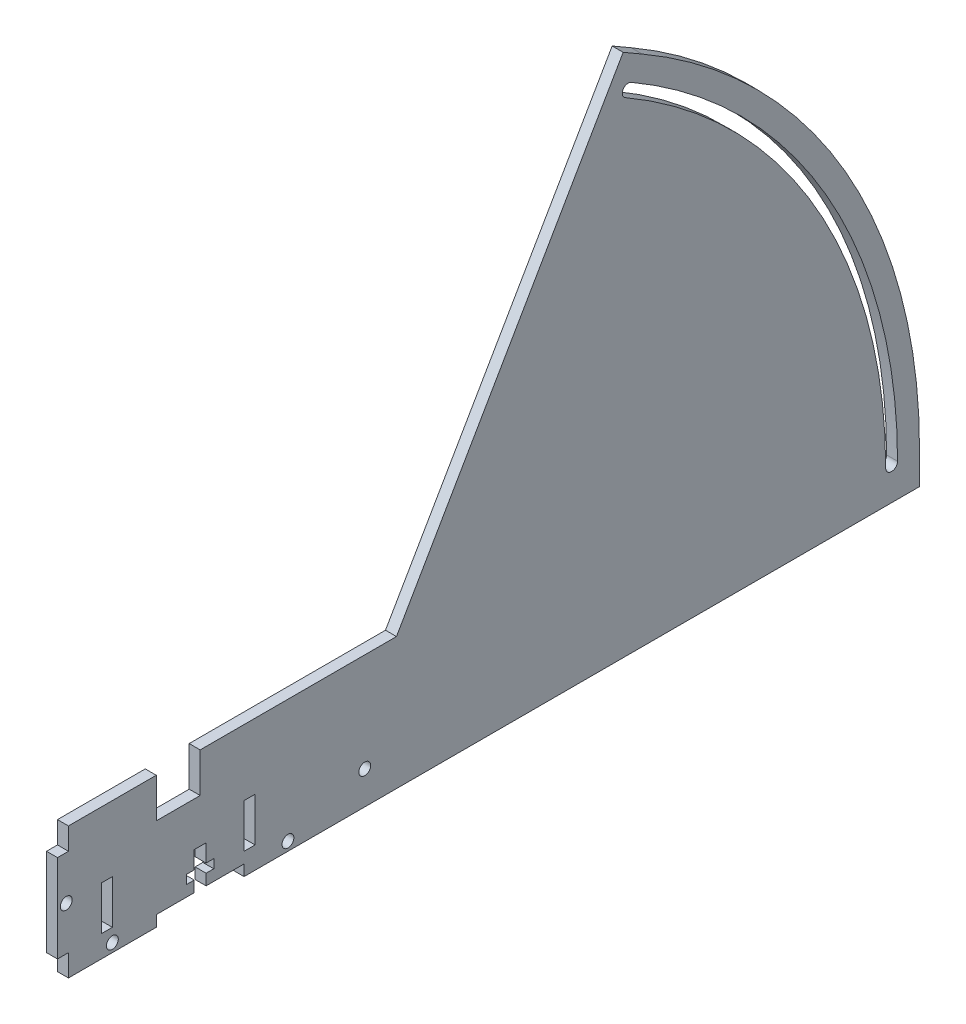
from build123d import *

# Parameters (mm, degrees)
SKETCH1_R           = 1.7145
SKETCH1_W           = 3.175
SKETCH1_H           = 12.7
BOSS_EXTRUDE2_DEPTH = 3.175


with BuildPart() as part:
    # Sketch1 → Boss-Extrude2 (new body)
    with BuildSketch(Plane(origin=(0, 0, 0), x_dir=(0, 0, -1), z_dir=(1, 0, 0))):
        with BuildLine():
            Line((0, 0), (160.4645, 0))
            Line((160.4645, 0), (160.4645, 9.53262))
            ThreePointArc((160.4645, 9.53262), (138.966333406, 89.76487), (80.23225, 148.498953406))
            Line((80.23225, 148.498953406), (74.732988686, 151.673953406))
            Line((74.732988686, 151.673953406), (9.161036114, 38.1))
            Line((9.161036114, 38.1), (-47.625, 38.1))
            Line((-47.625, 38.1), (-47.625, 26.67))
            Line((-47.625, 26.67), (-60.325, 26.67))
            Line((-60.325, 26.67), (-60.325, 38.1))
            Line((-60.325, 38.1), (-85.725, 38.1))
            Line((-85.725, 38.1), (-85.725, 31.75))
            Line((-85.725, 31.75), (-88.9, 31.75))
            Line((-88.9, 31.75), (-88.9, 6.35))
            Line((-88.9, 6.35), (-85.725, 6.35))
            Line((-85.725, 6.35), (-85.725, 0))
            Line((-85.725, 0), (-60.325, 0))
            Line((-60.325, 0), (-60.325, 3.175))
            Line((-60.325, 3.175), (-49.3395, 3.175))
            Line((-49.3395, 3.175), (-49.3395, 6.35))
            Line((-49.3395, 6.35), (-51.562, 6.35))
            Line((-51.562, 6.35), (-51.562, 8.89))
            Line((-51.562, 8.89), (-49.3395, 8.89))
            Line((-49.3395, 8.89), (-49.3395, 13.97))
            Line((-49.3395, 13.97), (-45.9105, 13.97))
            Line((-45.9105, 13.97), (-45.9105, 8.89))
            Line((-45.9105, 8.89), (-43.688, 8.89))
            Line((-43.688, 8.89), (-43.688, 6.35))
            Line((-43.688, 6.35), (-45.9105, 6.35))
            Line((-45.9105, 6.35), (-45.9105, 3.175))
            Line((-45.9105, 3.175), (-34.925, 3.175))
            Line((-34.925, 3.175), (-34.925, 0))
            Line((-34.925, 0), (0, 0))
        make_face()
        with Locations((-86.36, 19.05)):
            Circle(SKETCH1_R, mode=Mode.SUBTRACT)
        with Locations((0, 9.53262)):
            Circle(SKETCH1_R, mode=Mode.SUBTRACT)
        with Locations((-73.025, 2.54)):
            Circle(SKETCH1_R, mode=Mode.SUBTRACT)
        with Locations((-22.225, 2.54)):
            Circle(SKETCH1_R, mode=Mode.SUBTRACT)
        with Locations((-74.6125, 12.7)):
            Rectangle(SKETCH1_W, SKETCH1_H, mode=Mode.SUBTRACT)
        with Locations((-33.3375, 12.7)):
            Rectangle(SKETCH1_W, SKETCH1_H, mode=Mode.SUBTRACT)
        with BuildLine():
            ThreePointArc((154.1145, 9.53262), (133.467072092, 86.58987), (77.05725, 142.999692092))
            ThreePointArc((77.05725, 142.999692092), (74.715199445, 142.372141537), (75.34275, 140.030090982))
            ThreePointArc((75.34275, 140.030090982), (130.497470982, 84.87537), (150.6855, 9.53262))
            ThreePointArc((150.6855, 9.53262), (152.4, 7.81812), (154.1145, 9.53262))
        make_face(mode=Mode.SUBTRACT)
    extrude(amount=BOSS_EXTRUDE2_DEPTH)


solid = part.part
